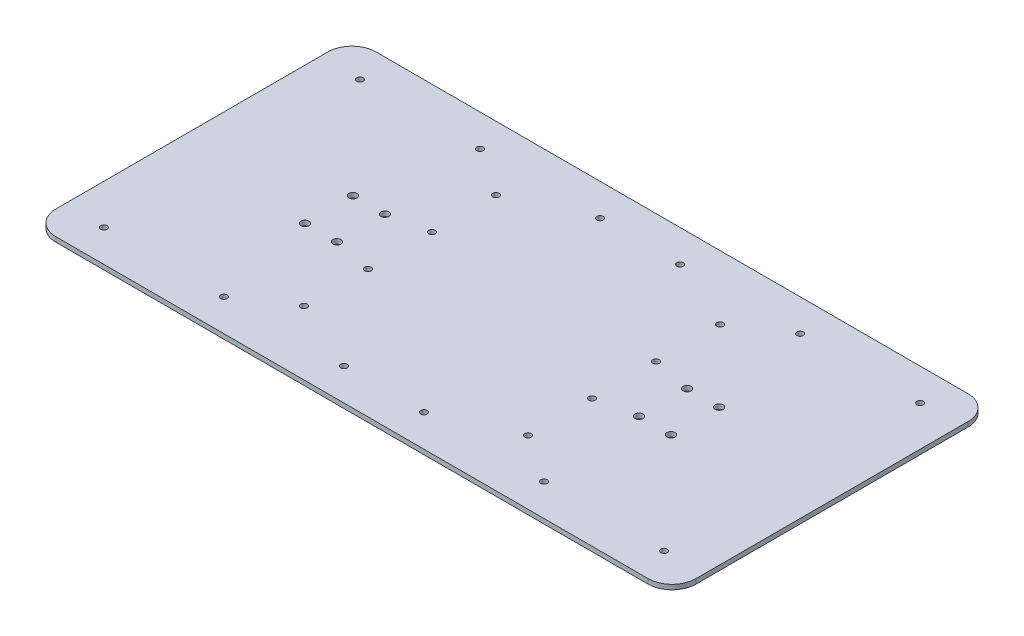
from build123d import *

# Parameters (mm, degrees)
EXTRUDE_2_DEPTH     = 3
SKETCH_3_R          = 2.5
CUT_EXTRUDE_1_DEPTH = 3
SKETCH_4_R          = 2
CUT_EXTRUDE_2_DEPTH = 224.626921456
SKETCH_5_R          = 2
CUT_EXTRUDE_3_DEPTH = 224.626921456
SKETCH_6_R          = 2
CUT_EXTRUDE_4_DEPTH = 224.626921456
SKETCH_8_R          = 2
CUT_EXTRUDE_6_DEPTH = 224.626921456


with BuildPart() as part:
    # 草图2 → 凸台-拉伸2 (new body)
    with BuildSketch(Plane(origin=(0, 0, 0), x_dir=(1, 0, 0), z_dir=(0, 1, 0))):
        with BuildLine():
            Line((-185, 100), (185, 100))
            ThreePointArc((185, 100), (195.606601718, 95.606601718), (200, 85))
            Line((200, 85), (200, -85))
            ThreePointArc((200, -85), (195.606601718, -95.606601718), (185, -100))
            Line((185, -100), (-185, -100))
            ThreePointArc((-185, -100), (-195.606601718, -95.606601718), (-200, -85))
            Line((-200, -85), (-200, 85))
            ThreePointArc((-200, 85), (-195.606601718, 95.606601718), (-185, 100))
        make_face()
    extrude(amount=EXTRUDE_2_DEPTH)

    # 草图3 → 切除-拉伸1 (cut)
    with BuildSketch(Plane(origin=(0, 3, 0), x_dir=(1, 0, 0), z_dir=(0, 1, 0))):
        with Locations(Location((-114.4, 15, 0), (0, 0, 270))):
            Circle(SKETCH_3_R)
        with Locations(Location((-94.4, 15, 0), (0, 0, 270))):
            Circle(SKETCH_3_R)
        with Locations(Location((-114.4, -15, 0), (0, 0, 270))):
            Circle(SKETCH_3_R)
        with Locations(Location((-94.4, -15, 0), (0, 0, 270))):
            Circle(SKETCH_3_R)
        with Locations(Location((94.4, 15, 0), (0, 0, 270))):
            Circle(SKETCH_3_R)
        with Locations(Location((114.4, 15, 0), (0, 0, 270))):
            Circle(SKETCH_3_R)
        with Locations(Location((114.4, -15, 0), (0, 0, 270))):
            Circle(SKETCH_3_R)
        with Locations(Location((94.4, -15, 0), (0, 0, 270))):
            Circle(SKETCH_3_R)
    extrude(amount=-CUT_EXTRUDE_1_DEPTH, mode=Mode.SUBTRACT)

    # 草图4 → 切除-拉伸2 (cut, through all)
    with BuildSketch(Plane(origin=(0, 3, 0), x_dir=(1, 0, 0), z_dir=(0, 1, 0))):
        with Locations(Location((-175, 80, 0), (0, 0, 270))):
            Circle(SKETCH_4_R)
        with Locations(Location((-100, 80, 0), (0, 0, 270))):
            Circle(SKETCH_4_R)
        with Locations(Location((-25, 80, 0), (0, 0, 270))):
            Circle(SKETCH_4_R)
        with Locations(Location((175, 80, 0), (0, 0, 270))):
            Circle(SKETCH_4_R)
        with Locations(Location((100, 80, 0), (0, 0, 270))):
            Circle(SKETCH_4_R)
        with Locations(Location((25, 80, 0), (0, 0, 270))):
            Circle(SKETCH_4_R)
    extrude(amount=-CUT_EXTRUDE_2_DEPTH, mode=Mode.SUBTRACT)

    # 草图5 → 切除-拉伸3 (cut, through all)
    with BuildSketch(Plane(origin=(0, 3, 0), x_dir=(1, 0, 0), z_dir=(0, 1, 0))):
        with Locations(Location((-175, -80, 0), (0, 0, 270))):
            Circle(SKETCH_5_R)
        with Locations(Location((-100, -80, 0), (0, 0, 270))):
            Circle(SKETCH_5_R)
        with Locations(Location((-25, -80, 0), (0, 0, 270))):
            Circle(SKETCH_5_R)
        with Locations(Location((25, -80, 0), (0, 0, 270))):
            Circle(SKETCH_5_R)
        with Locations(Location((100, -80, 0), (0, 0, 270))):
            Circle(SKETCH_5_R)
        with Locations(Location((175, -80, 0), (0, 0, 270))):
            Circle(SKETCH_5_R)
    extrude(amount=-CUT_EXTRUDE_3_DEPTH, mode=Mode.SUBTRACT)

    # 草图6 → 切除-拉伸4 (cut, through all)
    with BuildSketch(Plane(origin=(0, 3, 0), x_dir=(1, 0, 0), z_dir=(0, 1, 0))):
        with Locations(Location((-70, 60, 0), (0, 0, 270))):
            Circle(SKETCH_6_R)
        with Locations(Location((-70, 20, 0), (0, 0, 270))):
            Circle(SKETCH_6_R)
        with Locations(Location((-70, -20, 0), (0, 0, 270))):
            Circle(SKETCH_6_R)
        with Locations(Location((-70, -60, 0), (0, 0, 270))):
            Circle(SKETCH_6_R)
    extrude(amount=-CUT_EXTRUDE_4_DEPTH, mode=Mode.SUBTRACT)

    # 草图8 → 切除-拉伸6 (cut, through all)
    with BuildSketch(Plane(origin=(0, 3, 0), x_dir=(1, 0, 0), z_dir=(0, 1, 0))):
        with Locations(Location((70, 60, 0), (0, 0, 270))):
            Circle(SKETCH_8_R)
        with Locations(Location((70, 20, 0), (0, 0, 270))):
            Circle(SKETCH_8_R)
        with Locations(Location((70, -20, 0), (0, 0, 270))):
            Circle(SKETCH_8_R)
        with Locations(Location((70, -60, 0), (0, 0, 270))):
            Circle(SKETCH_8_R)
    extrude(amount=-CUT_EXTRUDE_6_DEPTH, mode=Mode.SUBTRACT)


solid = part.part
